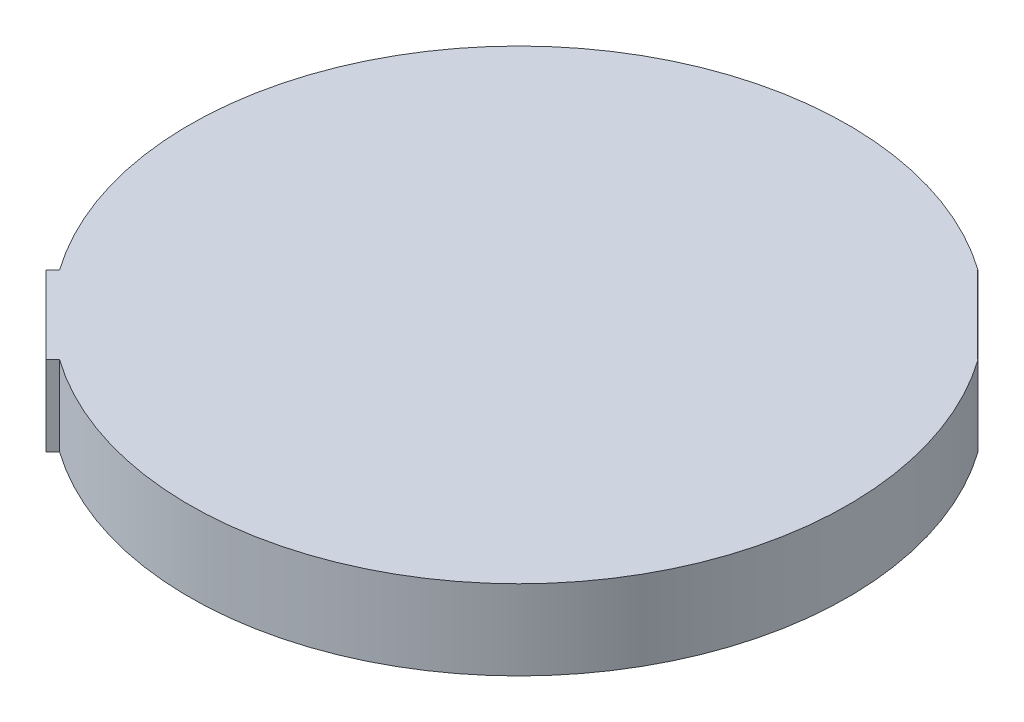
from build123d import *

# Parameters (mm, degrees)
SKETCH1_R           = 330
BOSS_EXTRUDE1_DEPTH = 80
BOSS_EXTRUDE2_START = -80
BOSS_EXTRUDE2_DEPTH = 80
SKETCH7_W           = 110
SKETCH7_H           = 80
BOSS_EXTRUDE3_DEPTH = 650.38438807
SKETCH9_W           = 110
SKETCH9_H           = 80
CUT_EXTRUDE4_DEPTH  = 12
SKETCH10_R          = 31
CUT_EXTRUDE5_DEPTH  = 13


with BuildPart() as part:
    # Sketch1 → Boss-Extrude1 (new body)
    with BuildSketch(Plane(origin=(0, 0, 0), x_dir=(1, 0, 0), z_dir=(0, 1, 0))):
        with Locations(Location((0, 0, 0), (0, 0, 270))):
            Circle(SKETCH1_R)
    extrude(amount=BOSS_EXTRUDE1_DEPTH)

    # Sketch6 → Boss-Extrude2 (add)
    with BuildSketch(Plane(origin=(0, 80, 0), x_dir=(1, 0, 0), z_dir=(0, 1, 0)).offset(BOSS_EXTRUDE2_START)):
        with BuildLine():
            Line((-272.236110757, -194.454364826), (-275.771644663, -197.989898732))
            Line((-275.771644663, -197.989898732), (-197.989898732, -275.771644663))
            Line((-197.989898732, -275.771644663), (-194.454364826, -272.236110757))
            Line((-194.454364826, -272.236110757), (-191.190634332, -268.972380262))
            ThreePointArc((-191.190634332, -268.972380262), (-233.345237792, -233.345237792), (-268.972380262, -191.190634332))
            Line((-268.972380262, -191.190634332), (-272.236110757, -194.454364826))
        make_face()
    extrude(amount=BOSS_EXTRUDE2_DEPTH)

    # Sketch7 → Boss-Extrude3 (add)
    with BuildSketch(Plane(origin=(229.809703886, 0, -229.809703886), x_dir=(0.7071067811865476, 0, 0.7071067811865476), z_dir=(-0.7071067811865476, 0, 0.7071067811865476))):
        with Locations((0, 40)):
            Rectangle(SKETCH7_W, SKETCH7_H)
    extrude(amount=BOSS_EXTRUDE3_DEPTH)

    # Sketch9 → Cut-Extrude4 (cut)
    with BuildSketch(Plane(origin=(229.809703886, 0, -229.809703886), x_dir=(0.7071067811865476, 0, 0.7071067811865476), z_dir=(-0.7071067811865476, 0, 0.7071067811865476))):
        with Locations((0, 40)):
            Rectangle(SKETCH9_W, SKETCH9_H)
    extrude(amount=-CUT_EXTRUDE4_DEPTH, mode=Mode.SUBTRACT)

    # Sketch10 → Cut-Extrude5 (cut)
    with BuildSketch(Plane(origin=(229.809703886, 0, -229.809703886), x_dir=(-0.7071067811865475, 0, -0.7071067811865477), z_dir=(0.7071067811865477, 0, -0.7071067811865475))):
        with Locations((0, 40)):
            Circle(SKETCH10_R)
    extrude(amount=-CUT_EXTRUDE5_DEPTH, mode=Mode.SUBTRACT)


solid = part.part
